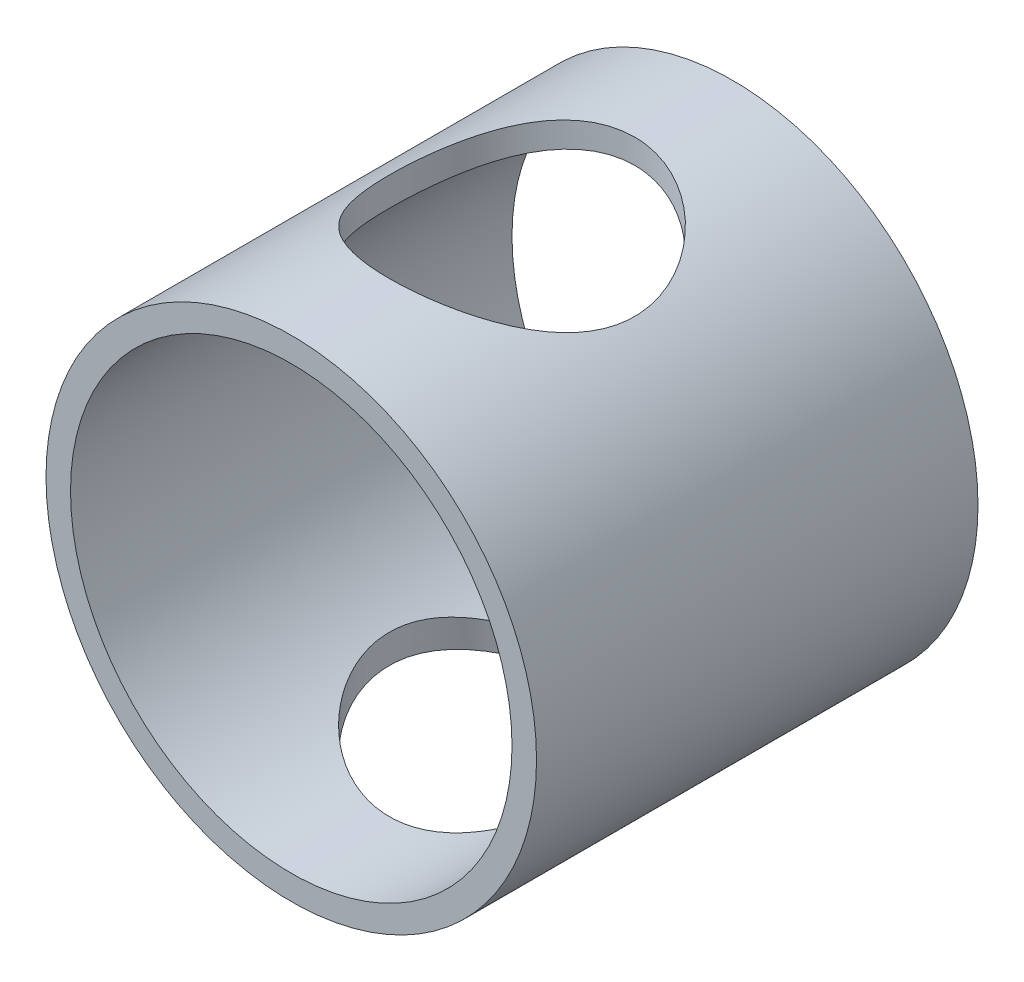
from build123d import *

# Parameters (mm, degrees)
CROQUIS1_R                 = 31.75
CROQUIS1_R_2               = 28.575
SALIENTE_EXTRUIR1_DEPTH    = 57.15
CORTAR_EXTRUIR1_DEPTH      = 73.679071953
CORTAR_EXTRUIR1_DEPTH_BACK = 73.679071953
CROQUIS2_R                 = 15.875


with BuildPart() as part:
    # Croquis1 → Saliente-Extruir1 (new body)
    with BuildSketch(Plane.XY):
        Circle(CROQUIS1_R)
        Circle(CROQUIS1_R_2, mode=Mode.SUBTRACT)
    extrude(amount=SALIENTE_EXTRUIR1_DEPTH)

    # Croquis2 → Cortar-Extruir1 (cut, two sides: drawn at the far end of the back side and taken through both)
    with BuildSketch(Plane(origin=(0, 0, 0), x_dir=(1, 0, 0), z_dir=(0, 1, 0)).offset(-CORTAR_EXTRUIR1_DEPTH_BACK)):
        with Locations(Location((0, -28.575, 0), (0, 0, 90))):
            Circle(CROQUIS2_R)
    extrude(amount=CORTAR_EXTRUIR1_DEPTH + CORTAR_EXTRUIR1_DEPTH_BACK, mode=Mode.SUBTRACT)


solid = part.part
